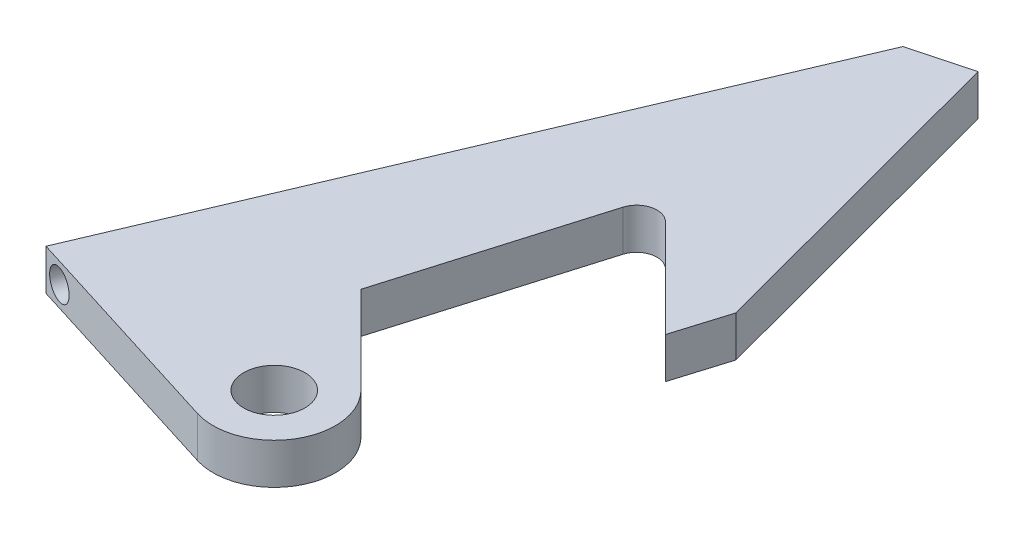
from build123d import *

# Parameters (mm, degrees)
SKETCH1_R                       = 4.7625
BOSS_EXTRUDE1_DEPTH             = 6.35
F_14_0_182_DIAMETER_HOLE1_D     = 4.6228
F_14_0_182_DIAMETER_HOLE1_DEPTH = 6.35
F_14_0_182_DIAMETER_HOLE1_TIP   = 1.388829235


with BuildPart() as part:
    # Sketch1 → Boss-Extrude1 (new body)
    with BuildSketch(Plane(origin=(0, 0, 0), x_dir=(1, 0, 0), z_dir=(0, 1, 0))):
        with BuildLine():
            Line((-2.715472603, -50.452570894), (-16.449210706, -36.716165316))
            Line((-16.449210706, -36.716165316), (-7.143929399, -5.302062091))
            ThreePointArc((-7.143929399, -5.302062091), (-4.881213446, -3.126502672), (-1.85461271, -3.95874678))
            Line((-1.85461271, -3.95874678), (13.315573809, -19.128933299))
            Line((13.315573809, -19.128933299), (15.879471691, -10.753687697))
            Line((15.879471691, -10.753687697), (2.2197595, 40.561165667))
            Line((2.2197595, 40.561165667), (-6.994225827, 38.108456959))
            Line((-6.994225827, 38.108456959), (-46.728023778, -55.399752843))
            Line((-46.728023778, -55.399752843), (-12.38156047, -66.157106701))
            ThreePointArc((-12.38156047, -66.157106701), (-1.47172138, -62.045085351), (-2.715472603, -50.452570894))
        make_face()
        with Locations(Location((-9.583361485, -57.052398719, 0), (0, 0, 270))):
            Circle(SKETCH1_R, mode=Mode.SUBTRACT)
    extrude(amount=BOSS_EXTRUDE1_DEPTH)

    # #14 (0.182) Diameter Hole1
    with Locations(Plane(origin=(-19.975553156, 0, 63.778659005), x_dir=(0.9542892760421928, 0, 0.29888455569143674), z_dir=(-0.29888455569143674, 0, 0.9542892760421928))):
        with Locations((-24.858921468, 3.175)):
            Hole(F_14_0_182_DIAMETER_HOLE1_D / 2, depth=F_14_0_182_DIAMETER_HOLE1_DEPTH)
            with Locations((0, 0, -(F_14_0_182_DIAMETER_HOLE1_DEPTH + F_14_0_182_DIAMETER_HOLE1_TIP / 2))):  # 118° drill point
                Cone(0, F_14_0_182_DIAMETER_HOLE1_D / 2, F_14_0_182_DIAMETER_HOLE1_TIP, mode=Mode.SUBTRACT)


solid = part.part
